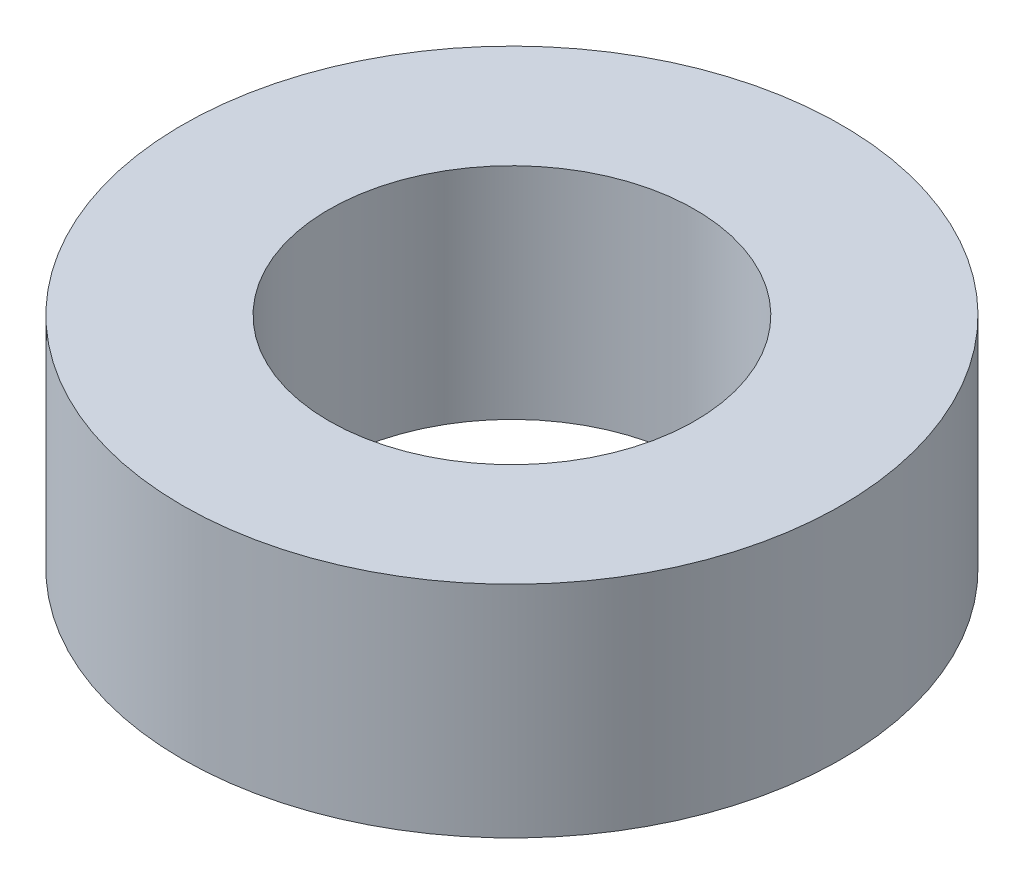
from build123d import *

# Parameters (mm, degrees)
SKETCH1_R           = 9
SKETCH1_R_2         = 5
BOSS_EXTRUDE1_DEPTH = 3


with BuildPart() as part:
    # Sketch1 → Boss-Extrude1 (new, symmetric)
    with BuildSketch(Plane(origin=(0, 0, 0), x_dir=(1, 0, 0), z_dir=(0, 1, 0))):
        with Locations(Location((0, 0, 0), (0, 0, 270))):
            Circle(SKETCH1_R)
        with Locations(Location((0, 0, 0), (0, 0, 270))):
            Circle(SKETCH1_R_2, mode=Mode.SUBTRACT)
    extrude(amount=BOSS_EXTRUDE1_DEPTH, both=True)


solid = part.part
